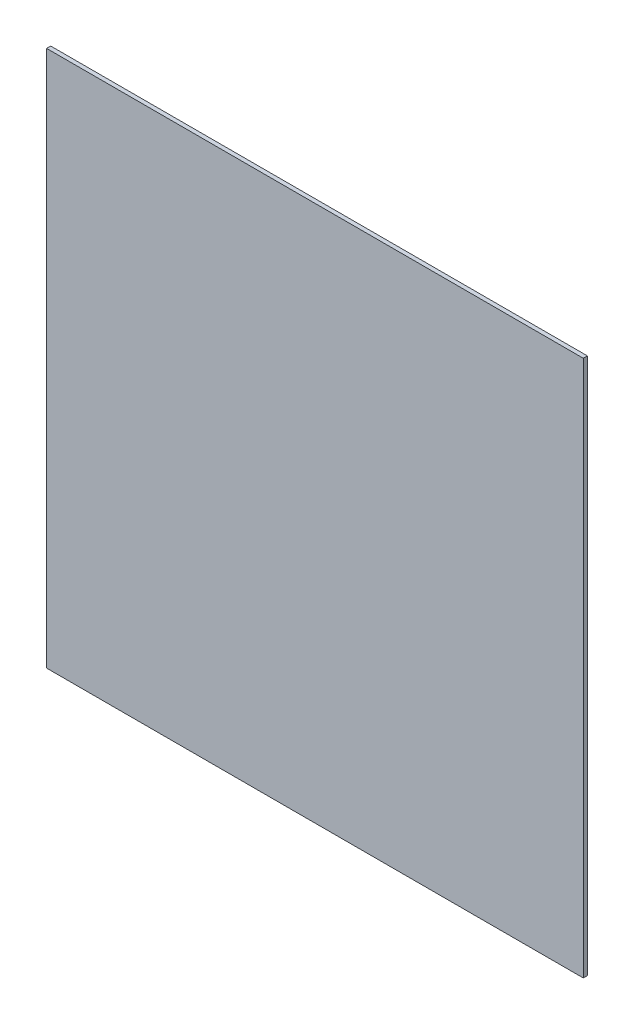
from build123d import *

# Parameters (mm, degrees)
SKETCH_1_W      = 391
SKETCH_1_H      = 391
EXTRUDE_1_DEPTH = 3


with BuildPart() as part:
    # 草圖1 → 填料-伸長1 (new body)
    with BuildSketch(Plane.XY):
        Rectangle(SKETCH_1_W, SKETCH_1_H)
    extrude(amount=EXTRUDE_1_DEPTH)


solid = part.part
